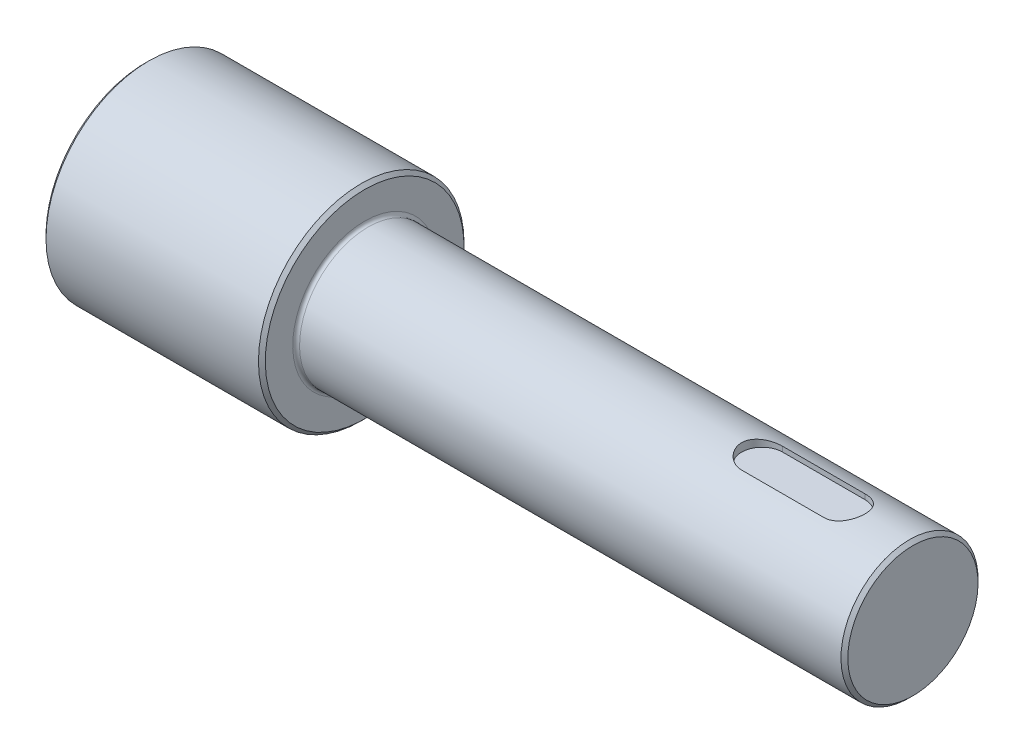
from build123d import *

# Parameters (mm, degrees)
CHAMFER_1_SIZE      = 0.5
FILLET_1_R          = 0.5
CUT_EXTRUDE_1_DEPTH = 1.2


with BuildPart() as part:
    # Эскиз1 → Повернуть1 (revolve)
    with BuildSketch(Plane.XY):
        Polygon((0, 0), (0, 15), (32, 15), (32, 10), (112, 10), (112, 0), align=None)
    revolve(axis=Axis((112, 0, 0), (-1, 0, 0)))

    # Фаска1
    chamfer_1_edges = [part.edges().sort_by_distance(p)[0] for p in [
        (112, -10, 0),
        (32, -15, 0),
        (0, -15, 0),
    ]]
    chamfer(chamfer_1_edges, length=CHAMFER_1_SIZE)

    # Скругление1
    fillet_1_edges = [part.edges().sort_by_distance(p)[0] for p in [
        (32, -10, 0),
    ]]
    fillet(fillet_1_edges, radius=FILLET_1_R)

    # Эскиз2 → Вырез-Вытянуть1 (cut)
    with BuildSketch(Plane(origin=(0, 10, 0), x_dir=(1, 0, 0), z_dir=(0, 1, 0))):
        with BuildLine():
            Line((90, 3), (102, 3))
            ThreePointArc((102, 3), (105, 0), (102, -3))
            Line((102, -3), (90, -3))
            ThreePointArc((90, -3), (87, 0), (90, 3))
        make_face()
    extrude(amount=-CUT_EXTRUDE_1_DEPTH, mode=Mode.SUBTRACT)


solid = part.part
